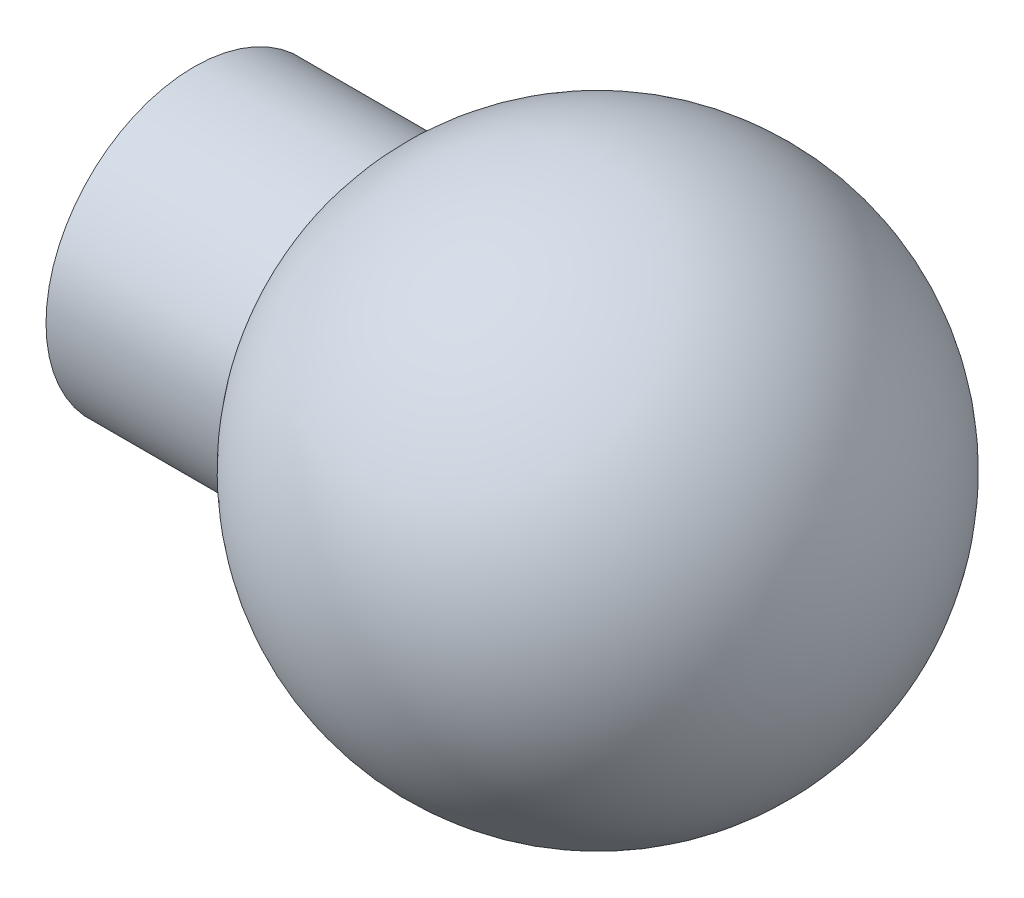
from build123d import *

# Parameters (mm, degrees)
SKETCH3_R           = 11
BOSS_EXTRUDE1_DEPTH = 30
SKETCH4_W           = 7
SKETCH4_H           = 7
CUT_EXTRUDE1_DEPTH  = 6


with BuildPart() as part:
    # Sketch1 → Revolve1 (revolve)
    with BuildSketch(Plane.XY):
        with BuildLine():
            Line((20, 0), (-20, 0))
            ThreePointArc((-20, 0), (0, 20), (20, 0))
        make_face()
    revolve(axis=Axis((-20, 0, 0), (1, 0, 0)))

    # Sketch3 → Boss-Extrude1 (add)
    with BuildSketch(Plane(origin=(0, 0, 0), x_dir=(0, 0, -1), z_dir=(1, 0, 0))):
        Circle(SKETCH3_R)
    extrude(amount=-BOSS_EXTRUDE1_DEPTH)

    # Sketch4 → Cut-Extrude1 (cut)
    with BuildSketch(Plane.ZY.offset(30)):
        Rectangle(SKETCH4_W, SKETCH4_H)
    extrude(amount=-CUT_EXTRUDE1_DEPTH, mode=Mode.SUBTRACT)


solid = part.part
